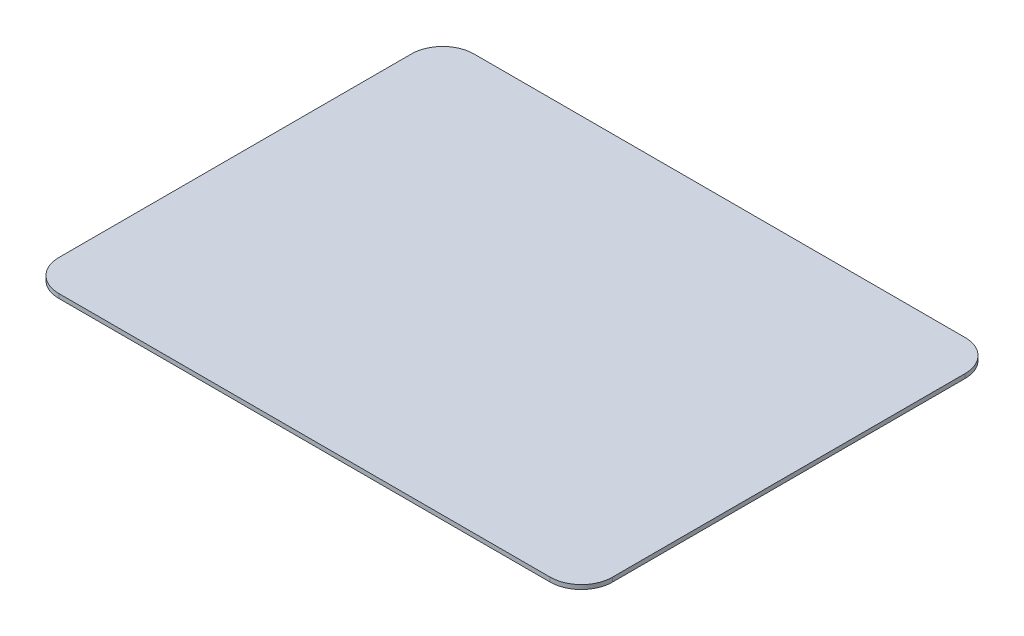
from build123d import *

# Parameters (mm, degrees)
SKETCH1_W           = 293.2938
SKETCH1_H           = 219.8624
BOSS_EXTRUDE1_DEPTH = 2.286
FILLET1_R           = 16.51


with BuildPart() as part:
    # Sketch1 → Boss-Extrude1 (new body)
    with BuildSketch(Plane(origin=(0, 0, 0), x_dir=(1, 0, 0), z_dir=(0, 1, 0))):
        Rectangle(SKETCH1_W, SKETCH1_H)
    extrude(amount=BOSS_EXTRUDE1_DEPTH)

    # Fillet1
    fillet1_edges = [part.edges().sort_by_distance(p)[0] for p in [
        (146.6469, 1.143, 109.9312),
        (-146.6469, 1.143, 109.9312),
        (-146.6469, 1.143, -109.9312),
        (146.6469, 1.143, -109.9312),
    ]]
    fillet(fillet1_edges, radius=FILLET1_R)


solid = part.part
